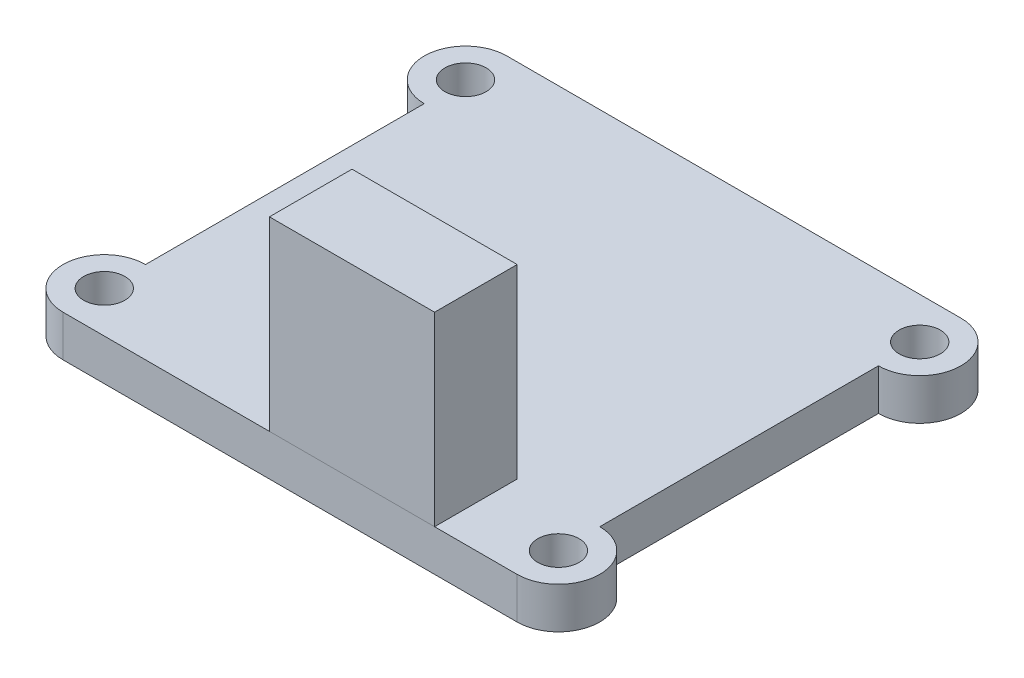
from build123d import *

# Parameters (mm, degrees)
SKETCH_1_R      = 1
EXTRUDE_1_DEPTH = 2
SKETCH_2_W      = 8
SKETCH_2_H      = 4
EXTRUDE_2_DEPTH = 9


with BuildPart() as part:
    # 草图1 → 凸台-拉伸1 (new body)
    with BuildSketch(Plane(origin=(0, 0, 0), x_dir=(1, 0, 0), z_dir=(0, 1, 0))):
        with BuildLine():
            Line((-11, -10.75), (11, -10.75))
            ThreePointArc((11, -10.75), (13, -8.75), (11, -6.75))
            Line((11, -6.75), (11, 6.75))
            ThreePointArc((11, 6.75), (13, 8.75), (11, 10.75))
            Line((11, 10.75), (-11, 10.75))
            ThreePointArc((-11, 10.75), (-13, 8.75), (-11, 6.75))
            Line((-11, 6.75), (-11, -6.75))
            ThreePointArc((-11, -6.75), (-13, -8.75), (-11, -10.75))
        make_face()
        with Locations(Location((-11, 8.75, 0), (0, 0, 270))):
            Circle(SKETCH_1_R, mode=Mode.SUBTRACT)
        with Locations(Location((11, 8.75, 0), (0, 0, 90))):
            Circle(SKETCH_1_R, mode=Mode.SUBTRACT)
        with Locations(Location((11, -8.75, 0), (0, 0, 270))):
            Circle(SKETCH_1_R, mode=Mode.SUBTRACT)
        with Locations(Location((-11, -8.75, 0), (0, 0, 90))):
            Circle(SKETCH_1_R, mode=Mode.SUBTRACT)
    extrude(amount=EXTRUDE_1_DEPTH)


with BuildPart() as body_2:
    # 草图2 → 凸台-拉伸2 (new body)
    with BuildSketch(Plane(origin=(0, 2, 0), x_dir=(1, 0, 0), z_dir=(0, 1, 0))):
        with Locations((3, -8.75)):
            Rectangle(SKETCH_2_W, SKETCH_2_H)
    extrude(amount=EXTRUDE_2_DEPTH)


solid = Compound([part.part, body_2.part])
